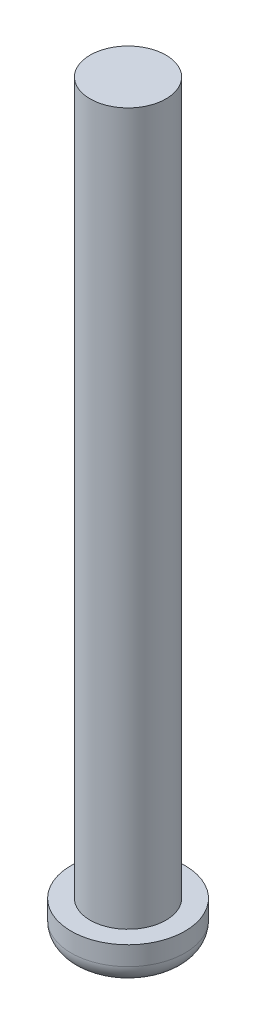
from build123d import *

# Parameters (mm, degrees)
CROQUIS1_R              = 4
SALIENTE_EXTRUIR1_DEPTH = 75
CROQUIS2_R              = 6
SALIENTE_EXTRUIR2_DEPTH = 4
REDONDEO1_R             = 2


with BuildPart() as part:
    # Croquis1 → Saliente-Extruir1 (new body)
    with BuildSketch(Plane(origin=(0, 0, 0), x_dir=(1, 0, 0), z_dir=(0, 1, 0))):
        with Locations(Location((0, 0, 0), (0, 0, 270))):
            Circle(CROQUIS1_R)
    extrude(amount=SALIENTE_EXTRUIR1_DEPTH)

    # Croquis2 → Saliente-Extruir2 (add)
    with BuildSketch(Plane(origin=(0, 0, 0), x_dir=(-1, 0, 0), z_dir=(0, -1, 0))):
        with Locations(Location((0, 0, 0), (0, 0, 90))):
            Circle(CROQUIS2_R)
    extrude(amount=SALIENTE_EXTRUIR2_DEPTH)

    # Redondeo1
    redondeo1_edges = [part.edges().sort_by_distance(p)[0] for p in [
        (0, -4, 6),
    ]]
    fillet(redondeo1_edges, radius=REDONDEO1_R)


solid = part.part
